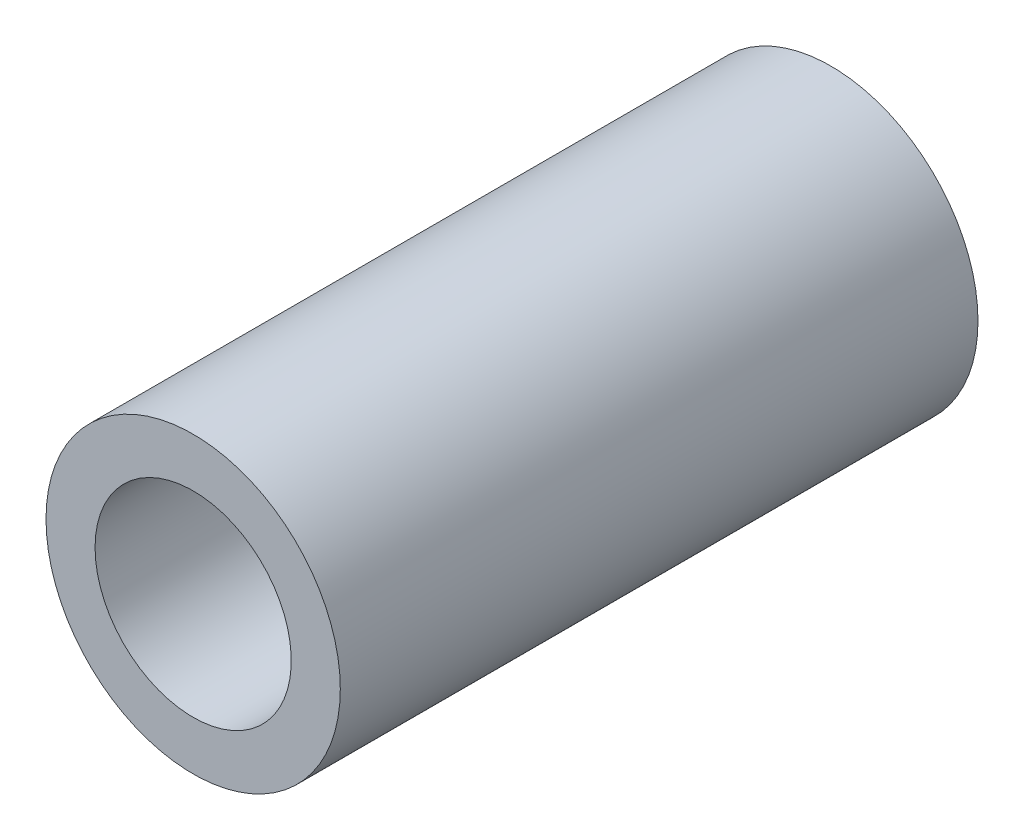
from build123d import *

# Parameters (mm, degrees)
ESQUISSE1_R        = 3
ESQUISSE1_R_2      = 2
BOSS_EXTRU_1_DEPTH = 13


with BuildPart() as part:
    # Esquisse1 → Boss.-Extru.1 (new body)
    with BuildSketch(Plane.XY):
        with Locations(Location((0, 0, 0), (0, 0, 180))):
            Circle(ESQUISSE1_R)
        with Locations(Location((0, 0, 0), (0, 0, 180))):
            Circle(ESQUISSE1_R_2, mode=Mode.SUBTRACT)
    extrude(amount=BOSS_EXTRU_1_DEPTH)


solid = part.part
